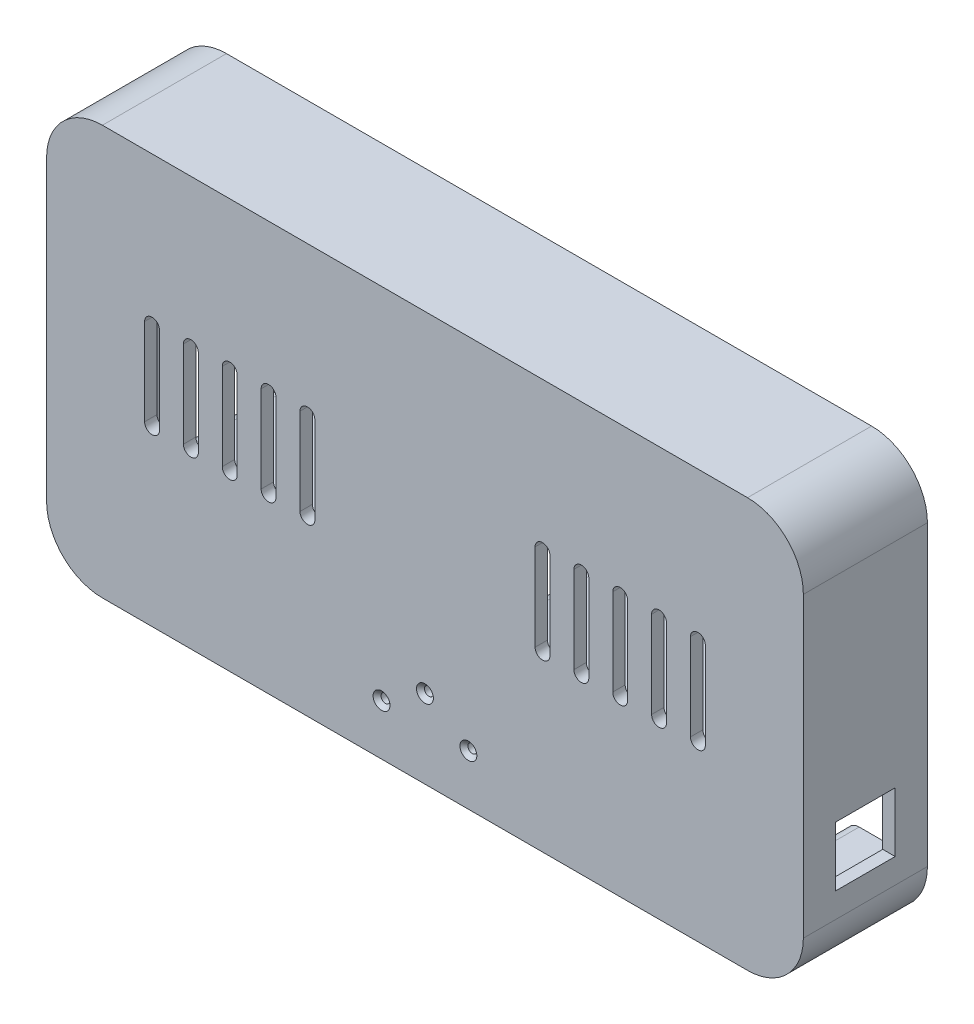
from build123d import *

# Parameters (mm, degrees)
EXTRUDE_1_DEPTH              = 50
CUT_EXTRUDE_1_DEPTH          = 45
CUT_EXTRUDE_2_DEPTH          = 5
CUT_EXTRUDE_3_DEPTH          = 5
SKETCH_1_7_R                 = 2.55
CUT_EXTRUDE_4_DEPTH          = 25
SKETCH_14_R                  = 1.6
SKETCH_14_W                  = 14
SKETCH_14_H                  = 9
USB_DEPTH                    = 5
SKETCH_16_W                  = 24
SKETCH_16_H                  = 24
CUT_EXTRUDE_12_DEPTH         = 5
SKETCH_18_W                  = 24
SKETCH_18_H                  = 24
CUT_EXTRUDE_13_DEPTH         = 5
EXTRUDE_2_DEPTH              = 40
SKETCH_29_4_R                = 2.85
SKETCH_29_4_R_2              = 1.15
EXTRUDE_4_DEPTH              = 5
SKETCH_29_5_R                = 3.4
SKETCH_29_5_R_2              = 1.2
EXTRUDE_5_DEPTH              = 6.5
CUT_EXTRUDE_START            = -2
SKETCH_29_R                  = 1.15
SKETCH_29_R_2                = 1.2
CUT_EXTRUDE_14_DEPTH         = 2
SKETCH_30_R                  = 1.6
CUT_EXTRUDE_21_DEPTH         = 5
HOLE_WIZARD_M3_1_D           = 3.6
HOLE_WIZARD_M3_1_CSINK_D     = 6.8
HOLE_WIZARD_M3_1_CSINK_ANGLE = 90
CUT_EXTRUDE_23_REACH         = 181.13
FILLET_1_R                   = 5


with BuildPart() as part:
    # 草图1 → 凸台-拉伸1 (new body)
    with BuildSketch(Plane.XY):
        with BuildLine():
            Line((-130, 82.5), (130, 82.5))
            ThreePointArc((130, 82.5), (145.909902577, 75.909902577), (152.5, 60))
            Line((152.5, 60), (152.5, -60))
            ThreePointArc((152.5, -60), (145.909902577, -75.909902577), (130, -82.5))
            Line((130, -82.5), (-130, -82.5))
            ThreePointArc((-130, -82.5), (-145.909902577, -75.909902577), (-152.5, -60))
            Line((-152.5, -60), (-152.5, 60))
            ThreePointArc((-152.5, 60), (-145.909902577, 75.909902577), (-130, 82.5))
        make_face()
    extrude(amount=EXTRUDE_1_DEPTH)

    # 草图1<4> → 切除-拉伸1 (cut)
    with BuildSketch(Plane.XY):
        with BuildLine():
            Line((124.95, 77.5), (-124.85, 77.5))
            Line((-124.85, 77.5), (-124.85, 60))
            ThreePointArc((-124.85, 60), (-126.358400077, 56.358400077), (-130, 54.85))
            Line((-130, 54.85), (-147.5, 54.85))
            Line((-147.5, 54.85), (-147.5, -54.85))
            Line((-147.5, -54.85), (-130, -54.85))
            ThreePointArc((-130, -54.85), (-126.358400077, -56.358400077), (-124.85, -60))
            Line((-124.85, -60), (-124.85, -77.5))
            Line((-124.85, -77.5), (124.95, -77.5))
            Line((124.95, -77.5), (124.95, -60))
            ThreePointArc((124.95, -60), (126.429110755, -56.429110755), (130, -54.95))
            Line((130, -54.95), (147.5, -54.95))
            Line((147.5, -54.95), (147.5, 54.95))
            Line((147.5, 54.95), (130, 54.95))
            ThreePointArc((130, 54.95), (126.429110755, 56.429110755), (124.95, 60))
            Line((124.95, 60), (124.95, 77.5))
        make_face()
    extrude(amount=CUT_EXTRUDE_1_DEPTH, mode=Mode.SUBTRACT)

    # 草图1<5> → 切除-拉伸2 (cut)
    with BuildSketch(Plane.XY):
        with BuildLine():
            ThreePointArc((-150.2, 60), (-144.28355698, 74.28355698), (-130, 80.2))
            Line((-130, 80.2), (130, 80.2))
            ThreePointArc((130, 80.2), (144.28355698, 74.28355698), (150.2, 60))
            Line((150.2, 60), (150.2, -60))
            ThreePointArc((150.2, -60), (144.28355698, -74.28355698), (130, -80.2))
            Line((130, -80.2), (-130, -80.2))
            ThreePointArc((-130, -80.2), (-144.28355698, -74.28355698), (-150.2, -60))
            Line((-150.2, -60), (-150.2, 60))
        make_face()
        with BuildLine():
            Line((-147.5, 60), (-147.5, -60))
            ThreePointArc((-147.5, -60), (-142.374368671, -72.374368671), (-130, -77.5))
            Line((-130, -77.5), (130, -77.5))
            ThreePointArc((130, -77.5), (142.374368671, -72.374368671), (147.5, -60))
            Line((147.5, -60), (147.5, 60))
            ThreePointArc((147.5, 60), (142.374368671, 72.374368671), (130, 77.5))
            Line((130, 77.5), (-130, 77.5))
            ThreePointArc((-130, 77.5), (-142.374368671, 72.374368671), (-147.5, 60))
        make_face(mode=Mode.SUBTRACT)
    extrude(amount=CUT_EXTRUDE_2_DEPTH, mode=Mode.SUBTRACT)

    # 草图1<6> → 切除-拉伸3 (cut)
    with BuildSketch(Plane.XY):
        with BuildLine():
            Line((-124.85, 77.5), (-130, 77.5))
            ThreePointArc((-130, 77.5), (-142.374368671, 72.374368671), (-147.5, 60))
            Line((-147.5, 60), (-147.5, 54.85))
            Line((-147.5, 54.85), (-130, 54.85))
            ThreePointArc((-130, 54.85), (-126.358400077, 56.358400077), (-124.85, 60))
            Line((-124.85, 60), (-124.85, 77.5))
        make_face()
        with BuildLine():
            Line((130, 77.5), (124.95, 77.5))
            Line((124.95, 77.5), (124.95, 60))
            ThreePointArc((124.95, 60), (126.429110755, 56.429110755), (130, 54.95))
            Line((130, 54.95), (147.5, 54.95))
            Line((147.5, 54.95), (147.5, 60))
            ThreePointArc((147.5, 60), (142.374368671, 72.374368671), (130, 77.5))
        make_face()
        with BuildLine():
            Line((-130, -54.85), (-147.5, -54.85))
            Line((-147.5, -54.85), (-147.5, -60))
            ThreePointArc((-147.5, -60), (-142.374368671, -72.374368671), (-130, -77.5))
            Line((-130, -77.5), (-124.85, -77.5))
            Line((-124.85, -77.5), (-124.85, -60))
            ThreePointArc((-124.85, -60), (-126.358400077, -56.358400077), (-130, -54.85))
        make_face()
        with BuildLine():
            Line((147.5, -60), (147.5, -54.95))
            Line((147.5, -54.95), (130, -54.95))
            ThreePointArc((130, -54.95), (126.429110755, -56.429110755), (124.95, -60))
            Line((124.95, -60), (124.95, -77.5))
            Line((124.95, -77.5), (130, -77.5))
            ThreePointArc((130, -77.5), (142.374368671, -72.374368671), (147.5, -60))
        make_face()
    extrude(amount=CUT_EXTRUDE_3_DEPTH, mode=Mode.SUBTRACT)

    # 草图1<7> → 切除-拉伸4 (cut)
    with BuildSketch(Plane.XY):
        with Locations((-130, -60)):
            Circle(SKETCH_1_7_R)
        with Locations((130, 60)):
            Circle(SKETCH_1_7_R)
        with Locations((130, -60)):
            Circle(SKETCH_1_7_R)
        with Locations((-130, 60)):
            Circle(SKETCH_1_7_R)
    extrude(amount=CUT_EXTRUDE_4_DEPTH, mode=Mode.SUBTRACT)

    # 草图14 → USB口 (cut)
    with BuildSketch(Plane.XZ.offset(82.5)):
        with Locations(Location((-70.9, 38, 0), (0, 0, 270))):
            Circle(SKETCH_14_R)
        with Locations(Location((-89.1, 38, 0), (0, 0, 270))):
            Circle(SKETCH_14_R)
        with Locations((-80, 38)):
            Rectangle(SKETCH_14_W, SKETCH_14_H)
    extrude(amount=-USB_DEPTH, mode=Mode.SUBTRACT)

    # 草图16 → 切除-拉伸12 (cut)
    with BuildSketch(Plane(origin=(152.5, 0, 0), x_dir=(0, 0, -1), z_dir=(1, 0, 0))):
        with Locations((-25, -38)):
            Rectangle(SKETCH_16_W, SKETCH_16_H)
    extrude(amount=-CUT_EXTRUDE_12_DEPTH, mode=Mode.SUBTRACT)

    # 草图18 → 切除-拉伸13 (cut)
    with BuildSketch(Plane.ZY.offset(152.5)):
        with Locations((25, -38)):
            Rectangle(SKETCH_18_W, SKETCH_18_H)
    extrude(amount=-CUT_EXTRUDE_13_DEPTH, mode=Mode.SUBTRACT)

    # 草图19 → 凸台-拉伸2 (add)
    with BuildSketch(Plane(origin=(0, 0, 45), x_dir=(-1, 0, 0), z_dir=(0, 0, -1))):
        with BuildLine():
            Line((-103, 40), (-18, 40))
            ThreePointArc((-18, 40), (-14, 36), (-18, 32))
            Line((-18, 32), (-103, 32))
            ThreePointArc((-103, 32), (-107, 36), (-103, 40))
        make_face()
        with BuildLine():
            Line((103, 40), (18, 40))
            ThreePointArc((18, 40), (14, 36), (18, 32))
            Line((18, 32), (103, 32))
            ThreePointArc((103, 32), (107, 36), (103, 40))
        make_face()
        with BuildLine():
            Line((-103, -20), (-23, -20))
            ThreePointArc((-23, -20), (-19, -24), (-23, -28))
            Line((-23, -28), (-103, -28))
            ThreePointArc((-103, -28), (-107, -24), (-103, -20))
        make_face()
        with BuildLine():
            Line((103, -20), (23, -20))
            ThreePointArc((23, -20), (19, -24), (23, -28))
            Line((23, -28), (103, -28))
            ThreePointArc((103, -28), (107, -24), (103, -20))
        make_face()
    extrude(amount=EXTRUDE_2_DEPTH)

    # 草图29<4> → 凸台-拉伸4 (add)
    # profile 1 of 2: a face of its own
    with BuildSketch(Plane(origin=(0, 0, 45), x_dir=(-1, 0, 0), z_dir=(0, 0, -1))):
        with Locations(Location((-17.5, -31.85, 0), (0, 0, 180))):
            Circle(SKETCH_29_4_R)
        with Locations((-17.5, -31.85)):
            Circle(SKETCH_29_4_R_2, mode=Mode.SUBTRACT)
    # profile 2 of 2: a face of its own
    with BuildSketch(Plane(origin=(0, 0, 45), x_dir=(-1, 0, 0), z_dir=(0, 0, -1))):
        with Locations((17.5, -31.85)):
            Circle(SKETCH_29_4_R)
        with Locations(Location((17.5, -31.85, 0), (0, 0, 180))):
            Circle(SKETCH_29_4_R_2, mode=Mode.SUBTRACT)
    extrude(amount=EXTRUDE_4_DEPTH)

    # 草图29<5> → 凸台-拉伸5 (add)
    # profile 1 of 4: a face of its own
    with BuildSketch(Plane(origin=(0, 0, 45), x_dir=(-1, 0, 0), z_dir=(0, 0, -1))):
        with Locations(Location((-30, 20, 0), (0, 0, 180))):
            Circle(SKETCH_29_5_R)
        with Locations(Location((-30, 20, 0), (0, 0, 180))):
            Circle(SKETCH_29_5_R_2, mode=Mode.SUBTRACT)
    # profile 2 of 4: a face of its own
    with BuildSketch(Plane(origin=(0, 0, 45), x_dir=(-1, 0, 0), z_dir=(0, 0, -1))):
        with Locations(Location((-30, -10, 0), (0, 0, 180))):
            Circle(SKETCH_29_5_R)
        with Locations(Location((-30, -10, 0), (0, 0, 180))):
            Circle(SKETCH_29_5_R_2, mode=Mode.SUBTRACT)
    # profile 3 of 4: a face of its own
    with BuildSketch(Plane(origin=(0, 0, 45), x_dir=(-1, 0, 0), z_dir=(0, 0, -1))):
        with Locations(Location((30, 20, 0), (0, 0, 180))):
            Circle(SKETCH_29_5_R)
        with Locations(Location((30, 20, 0), (0, 0, 180))):
            Circle(SKETCH_29_5_R_2, mode=Mode.SUBTRACT)
    # profile 4 of 4: a face of its own
    with BuildSketch(Plane(origin=(0, 0, 45), x_dir=(-1, 0, 0), z_dir=(0, 0, -1))):
        with Locations(Location((30, -10, 0), (0, 0, 180))):
            Circle(SKETCH_29_5_R)
        with Locations(Location((30, -10, 0), (0, 0, 180))):
            Circle(SKETCH_29_5_R_2, mode=Mode.SUBTRACT)
    extrude(amount=EXTRUDE_5_DEPTH)

    # 草图29 → 切除-拉伸14 (cut)
    with BuildSketch(Plane(origin=(0, 0, 45), x_dir=(-1, 0, 0), z_dir=(0, 0, -1)).offset(CUT_EXTRUDE_START)):
        with Locations((17.5, -31.85)):
            Circle(SKETCH_29_R)
        with Locations((-17.5, -31.85)):
            Circle(SKETCH_29_R)
        with Locations(Location((30, -10, 0), (0, 0, 180))):
            Circle(SKETCH_29_R_2)
        with Locations(Location((-30, -10, 0), (0, 0, 180))):
            Circle(SKETCH_29_R_2)
        with Locations(Location((-30, 20, 0), (0, 0, 180))):
            Circle(SKETCH_29_R_2)
        with Locations(Location((30, 20, 0), (0, 0, 180))):
            Circle(SKETCH_29_R_2)
    extrude(amount=CUT_EXTRUDE_14_DEPTH, mode=Mode.SUBTRACT)

    # 草图30 → 切除-拉伸21 (cut)
    with BuildSketch(Plane(origin=(0, 0, 45), x_dir=(-1, 0, 0), z_dir=(0, 0, -1))):
        with Locations((17.5, -62.0866)):
            Circle(SKETCH_30_R)
        with Locations((0, -50.85)):
            Circle(SKETCH_30_R)
        with Locations((-17.5, -62.0866)):
            Circle(SKETCH_30_R)
    extrude(amount=-CUT_EXTRUDE_21_DEPTH, mode=Mode.SUBTRACT)

    # M3 平头机械螺钉的锥形沉头孔1 (through all)
    with Locations(Plane.XY.offset(50)):
        with Locations((17.5, -62.0866), (0, -50.85), (-17.5, -62.0866)):
            CounterSinkHole(HOLE_WIZARD_M3_1_D / 2, HOLE_WIZARD_M3_1_CSINK_D / 2, counter_sink_angle=HOLE_WIZARD_M3_1_CSINK_ANGLE)

    # 草图38 → 切除-拉伸23 (cut, up to next)
    with BuildSketch(Plane(origin=(0, 0, 45), x_dir=(-1, 0, 0), z_dir=(0, 0, -1)), mode=Mode.PRIVATE) as cut_extrude_23_sk1:
        with BuildLine():
            Line((-107, 22.5), (-107, -12.5))
            ThreePointArc((-107, -12.5), (-110, -15.5), (-113, -12.5))
            Line((-113, -12.5), (-113, 22.5))
            ThreePointArc((-113, 22.5), (-110, 25.5), (-107, 22.5))
        make_face()
    cut_extrude_23_tool1 = extrude(cut_extrude_23_sk1.sketch, amount=-CUT_EXTRUDE_23_REACH, mode=Mode.PRIVATE) & part.part
    # 草图38 → 切除-拉伸23 (cut, up to next)
    with BuildSketch(Plane(origin=(0, 0, 45), x_dir=(-1, 0, 0), z_dir=(0, 0, -1)), mode=Mode.PRIVATE) as cut_extrude_23_sk2:
        with BuildLine():
            Line((-97.343565249, 22.5), (-97.343565249, -12.5))
            ThreePointArc((-97.343565249, -12.5), (-94.343565249, -15.5), (-91.343565249, -12.5))
            Line((-91.343565249, -12.5), (-91.343565249, 22.5))
            ThreePointArc((-91.343565249, 22.5), (-94.343565249, 25.5), (-97.343565249, 22.5))
        make_face()
    cut_extrude_23_tool2 = extrude(cut_extrude_23_sk2.sketch, amount=-CUT_EXTRUDE_23_REACH, mode=Mode.PRIVATE) & part.part
    # 草图38 → 切除-拉伸23 (cut, up to next)
    with BuildSketch(Plane(origin=(0, 0, 45), x_dir=(-1, 0, 0), z_dir=(0, 0, -1)), mode=Mode.PRIVATE) as cut_extrude_23_sk3:
        with BuildLine():
            Line((-81.687130498, 22.5), (-81.687130498, -12.5))
            ThreePointArc((-81.687130498, -12.5), (-78.687130498, -15.5), (-75.687130498, -12.5))
            Line((-75.687130498, -12.5), (-75.687130498, 22.5))
            ThreePointArc((-75.687130498, 22.5), (-78.687130498, 25.5), (-81.687130498, 22.5))
        make_face()
    cut_extrude_23_tool3 = extrude(cut_extrude_23_sk3.sketch, amount=-CUT_EXTRUDE_23_REACH, mode=Mode.PRIVATE) & part.part
    # 草图38 → 切除-拉伸23 (cut, up to next)
    with BuildSketch(Plane(origin=(0, 0, 45), x_dir=(-1, 0, 0), z_dir=(0, 0, -1)), mode=Mode.PRIVATE) as cut_extrude_23_sk4:
        with BuildLine():
            Line((-66.030695747, 22.5), (-66.030695747, -12.5))
            ThreePointArc((-66.030695747, -12.5), (-63.030695747, -15.5), (-60.030695747, -12.5))
            Line((-60.030695747, -12.5), (-60.030695747, 22.5))
            ThreePointArc((-60.030695747, 22.5), (-63.030695747, 25.5), (-66.030695747, 22.5))
        make_face()
    cut_extrude_23_tool4 = extrude(cut_extrude_23_sk4.sketch, amount=-CUT_EXTRUDE_23_REACH, mode=Mode.PRIVATE) & part.part
    # 草图38 → 切除-拉伸23 (cut, up to next)
    with BuildSketch(Plane(origin=(0, 0, 45), x_dir=(-1, 0, 0), z_dir=(0, 0, -1)), mode=Mode.PRIVATE) as cut_extrude_23_sk5:
        with BuildLine():
            Line((-50.374260997, 22.5), (-50.374260997, -12.5))
            ThreePointArc((-50.374260997, -12.5), (-47.374260997, -15.5), (-44.374260997, -12.5))
            Line((-44.374260997, -12.5), (-44.374260997, 22.5))
            ThreePointArc((-44.374260997, 22.5), (-47.374260997, 25.5), (-50.374260997, 22.5))
        make_face()
    cut_extrude_23_tool5 = extrude(cut_extrude_23_sk5.sketch, amount=-CUT_EXTRUDE_23_REACH, mode=Mode.PRIVATE) & part.part
    # 草图38 → 切除-拉伸23 (cut, up to next)
    with BuildSketch(Plane(origin=(0, 0, 45), x_dir=(-1, 0, 0), z_dir=(0, 0, -1)), mode=Mode.PRIVATE) as cut_extrude_23_sk6:
        with BuildLine():
            Line((107, 22.5), (107, -12.5))
            ThreePointArc((107, -12.5), (110, -15.5), (113, -12.5))
            Line((113, -12.5), (113, 22.5))
            ThreePointArc((113, 22.5), (110, 25.5), (107, 22.5))
        make_face()
    cut_extrude_23_tool6 = extrude(cut_extrude_23_sk6.sketch, amount=-CUT_EXTRUDE_23_REACH, mode=Mode.PRIVATE) & part.part
    # 草图38 → 切除-拉伸23 (cut, up to next)
    with BuildSketch(Plane(origin=(0, 0, 45), x_dir=(-1, 0, 0), z_dir=(0, 0, -1)), mode=Mode.PRIVATE) as cut_extrude_23_sk7:
        with BuildLine():
            Line((91.343565249, 22.5), (91.343565249, -12.5))
            ThreePointArc((91.343565249, -12.5), (94.343565249, -15.5), (97.343565249, -12.5))
            Line((97.343565249, -12.5), (97.343565249, 22.5))
            ThreePointArc((97.343565249, 22.5), (94.343565249, 25.5), (91.343565249, 22.5))
        make_face()
    cut_extrude_23_tool7 = extrude(cut_extrude_23_sk7.sketch, amount=-CUT_EXTRUDE_23_REACH, mode=Mode.PRIVATE) & part.part
    # 草图38 → 切除-拉伸23 (cut, up to next)
    with BuildSketch(Plane(origin=(0, 0, 45), x_dir=(-1, 0, 0), z_dir=(0, 0, -1)), mode=Mode.PRIVATE) as cut_extrude_23_sk8:
        with BuildLine():
            Line((75.687130498, 22.5), (75.687130498, -12.5))
            ThreePointArc((75.687130498, -12.5), (78.687130498, -15.5), (81.687130498, -12.5))
            Line((81.687130498, -12.5), (81.687130498, 22.5))
            ThreePointArc((81.687130498, 22.5), (78.687130498, 25.5), (75.687130498, 22.5))
        make_face()
    cut_extrude_23_tool8 = extrude(cut_extrude_23_sk8.sketch, amount=-CUT_EXTRUDE_23_REACH, mode=Mode.PRIVATE) & part.part
    # 草图38 → 切除-拉伸23 (cut, up to next)
    with BuildSketch(Plane(origin=(0, 0, 45), x_dir=(-1, 0, 0), z_dir=(0, 0, -1)), mode=Mode.PRIVATE) as cut_extrude_23_sk9:
        with BuildLine():
            Line((60.030695747, 22.5), (60.030695747, -12.5))
            ThreePointArc((60.030695747, -12.5), (63.030695747, -15.5), (66.030695747, -12.5))
            Line((66.030695747, -12.5), (66.030695747, 22.5))
            ThreePointArc((66.030695747, 22.5), (63.030695747, 25.5), (60.030695747, 22.5))
        make_face()
    cut_extrude_23_tool9 = extrude(cut_extrude_23_sk9.sketch, amount=-CUT_EXTRUDE_23_REACH, mode=Mode.PRIVATE) & part.part
    # 草图38 → 切除-拉伸23 (cut, up to next)
    with BuildSketch(Plane(origin=(0, 0, 45), x_dir=(-1, 0, 0), z_dir=(0, 0, -1)), mode=Mode.PRIVATE) as cut_extrude_23_sk10:
        with BuildLine():
            Line((44.374260997, 22.5), (44.374260997, -12.5))
            ThreePointArc((44.374260997, -12.5), (47.374260997, -15.5), (50.374260997, -12.5))
            Line((50.374260997, -12.5), (50.374260997, 22.5))
            ThreePointArc((50.374260997, 22.5), (47.374260997, 25.5), (44.374260997, 22.5))
        make_face()
    cut_extrude_23_tool10 = extrude(cut_extrude_23_sk10.sketch, amount=-CUT_EXTRUDE_23_REACH, mode=Mode.PRIVATE) & part.part
    add(cut_extrude_23_tool1.solids().sort_by_distance((110, 5, 45))[0], mode=Mode.SUBTRACT)
    add(cut_extrude_23_tool2.solids().sort_by_distance((94.343565, 5, 45))[0], mode=Mode.SUBTRACT)
    add(cut_extrude_23_tool3.solids().sort_by_distance((78.68713, 5, 45))[0], mode=Mode.SUBTRACT)
    add(cut_extrude_23_tool4.solids().sort_by_distance((63.030696, 5, 45))[0], mode=Mode.SUBTRACT)
    add(cut_extrude_23_tool5.solids().sort_by_distance((47.374261, 5, 45))[0], mode=Mode.SUBTRACT)
    add(cut_extrude_23_tool6.solids().sort_by_distance((-110, 5, 45))[0], mode=Mode.SUBTRACT)
    add(cut_extrude_23_tool7.solids().sort_by_distance((-94.343565, 5, 45))[0], mode=Mode.SUBTRACT)
    add(cut_extrude_23_tool8.solids().sort_by_distance((-78.68713, 5, 45))[0], mode=Mode.SUBTRACT)
    add(cut_extrude_23_tool9.solids().sort_by_distance((-63.030696, 5, 45))[0], mode=Mode.SUBTRACT)
    add(cut_extrude_23_tool10.solids().sort_by_distance((-47.374261, 5, 45))[0], mode=Mode.SUBTRACT)

    # 圆角1
    fillet_1_edges = [part.edges().sort_by_distance(p)[0] for p in [
        (26.6, 20, 45),
        (26.6, -10, 45),
        (-33.4, 20, 45),
        (-33.4, -10, 45),
    ]]
    fillet(fillet_1_edges, radius=FILLET_1_R)


solid = part.part
